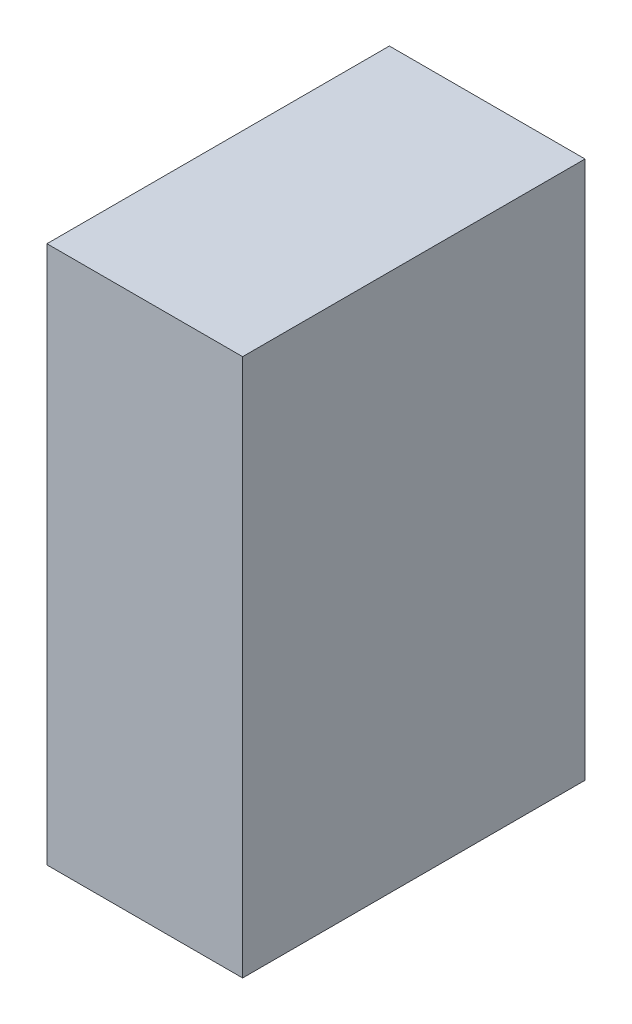
from build123d import *

# Parameters (mm, degrees)
ESBO_O1_W                = 101.6
ESBO_O1_H                = 279.4
RESSALTO_EXTRUS_O1_DEPTH = 177.8


with BuildPart() as part:
    # Esboço1 → Ressalto-extrusão1 (new body)
    with BuildSketch(Plane.XY):
        with Locations((50.8, 139.7)):
            Rectangle(ESBO_O1_W, ESBO_O1_H)
    extrude(amount=RESSALTO_EXTRUS_O1_DEPTH)


solid = part.part
